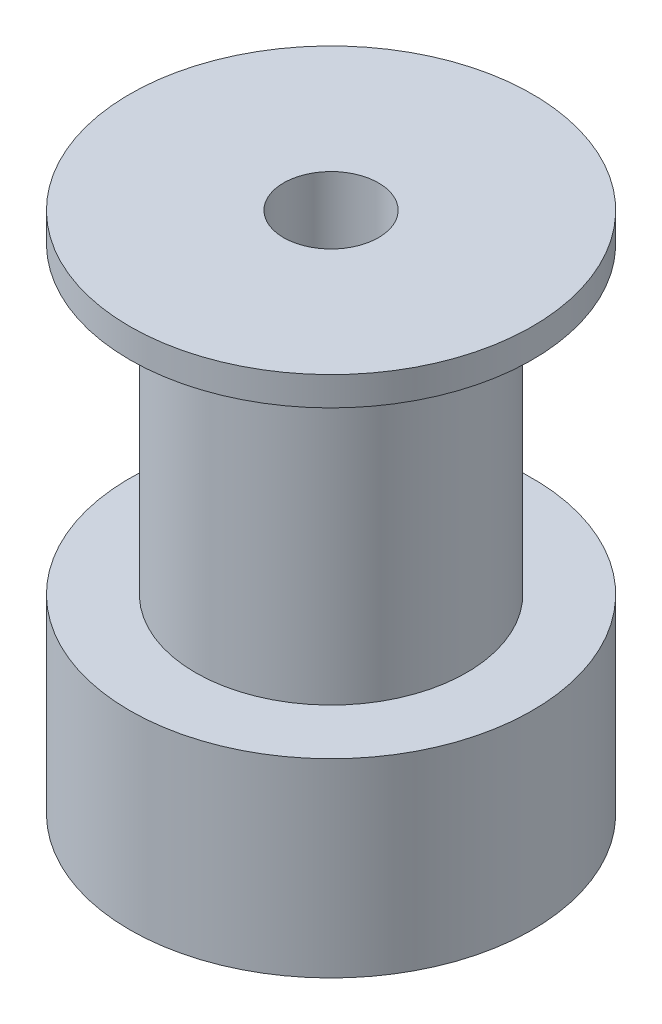
from build123d import *

# Parameters (mm, degrees)
SKETCH1_R           = 6.731
BOSS_EXTRUDE1_DEPTH = 17.4752
SKETCH2_W           = 2.1971
SKETCH2_H           = 10.16
SKETCH3_R           = 1.5875
CUT_EXTRUDE1_DEPTH  = 17.4752


with BuildPart() as part:
    # Sketch1 → Boss-Extrude1 (new body)
    with BuildSketch(Plane(origin=(0, 0, 0), x_dir=(1, 0, 0), z_dir=(0, 1, 0))):
        with Locations(Location((0, 0, 0), (0, 0, 270))):
            Circle(SKETCH1_R)
    extrude(amount=BOSS_EXTRUDE1_DEPTH)

    # Sketch2 → Cut-Revolve1 (revolve, cut)
    with BuildSketch(Plane(origin=(0, 0, 0), x_dir=(0, 0, -1), z_dir=(1, 0, 0)), mode=Mode.PRIVATE) as cut_revolve1_sk:
        with Locations((5.63245, 11.43)):
            Rectangle(SKETCH2_W, SKETCH2_H)
    revolve(cut_revolve1_sk.sketch.rotate(Axis((0, 18.309331677, 0), (0, -1, 0)), 180), axis=Axis((0, 18.309331677, 0), (0, -1, 0)), mode=Mode.SUBTRACT)

    # Sketch3 → Cut-Extrude1 (cut)
    with BuildSketch(Plane(origin=(0, 17.4752, 0), x_dir=(1, 0, 0), z_dir=(0, 1, 0))):
        with Locations(Location((0, 0, 0), (0, 0, 270))):
            Circle(SKETCH3_R)
    extrude(amount=-CUT_EXTRUDE1_DEPTH, mode=Mode.SUBTRACT)


solid = part.part
